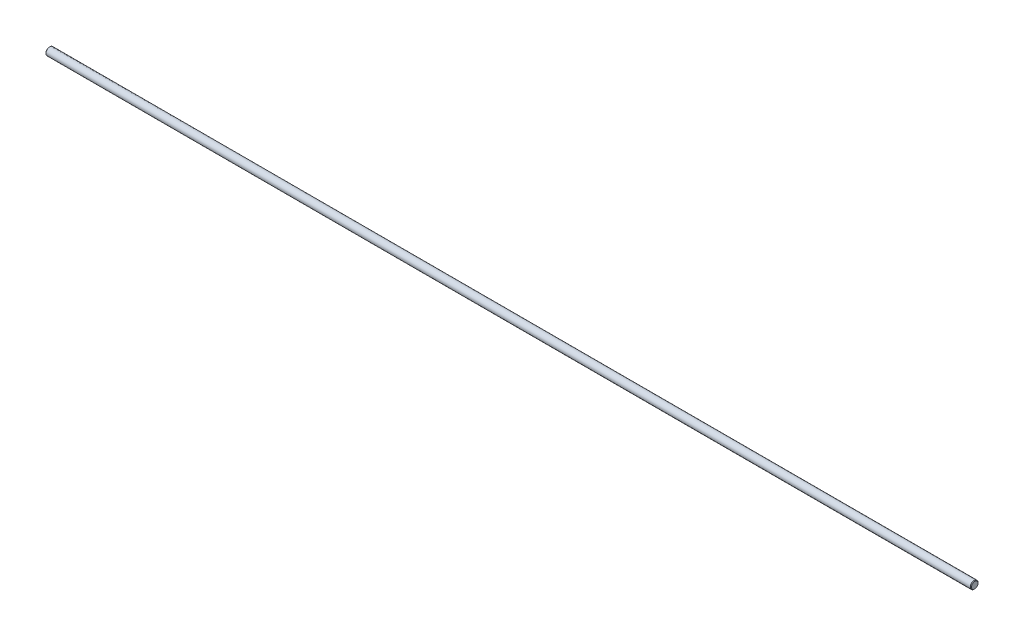
from build123d import *

# Parameters (mm, degrees)
SKETCH2_R           = 6.35
BOSS_EXTRUDE1_DEPTH = 1524
CHAMFER1_SIZE       = 0.9525


with BuildPart() as part:
    # Sketch2 → Boss-Extrude1 (new body)
    with BuildSketch(Plane(origin=(0, 0, 0), x_dir=(0, 0, -1), z_dir=(1, 0, 0))):
        Circle(SKETCH2_R)
    extrude(amount=-BOSS_EXTRUDE1_DEPTH)

    # Chamfer1
    chamfer1_edges = [part.edges().sort_by_distance(p)[0] for p in [
        (-1524, 0, 6.35),
        (0, 0, 6.35),
    ]]
    chamfer(chamfer1_edges, length=CHAMFER1_SIZE)


solid = part.part
